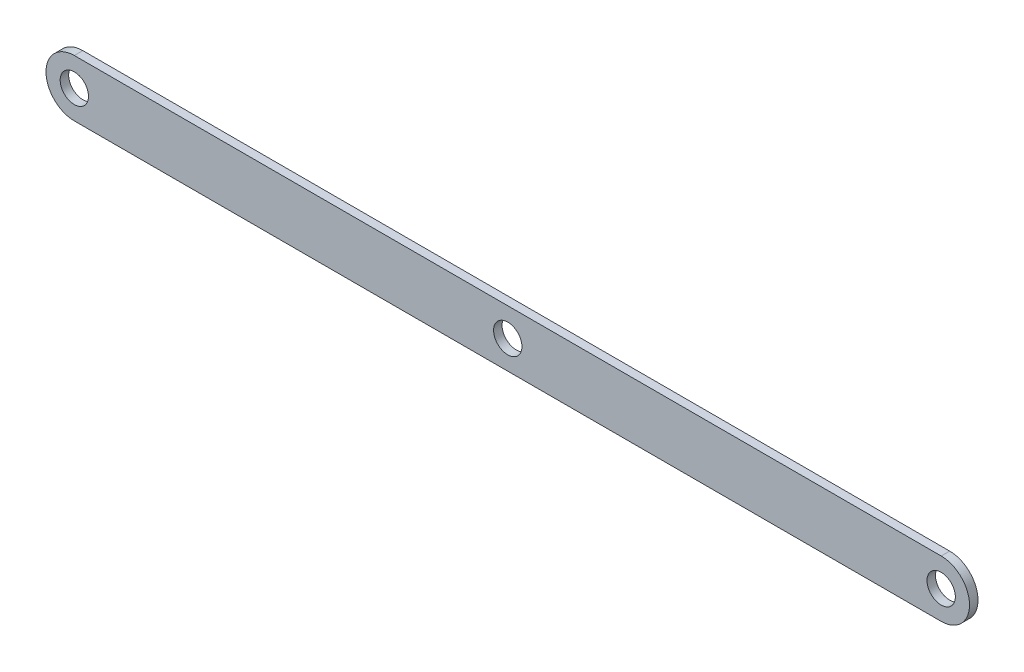
from build123d import *

# Parameters (mm, degrees)
SKETCH1_R           = 2.5
BOSS_EXTRUDE1_DEPTH = 1.5


with BuildPart() as part:
    # Sketch1 → Boss-Extrude1 (new body)
    with BuildSketch(Plane.XY):
        with BuildLine():
            Line((0, 5), (153, 5))
            ThreePointArc((153, 5), (158, 0), (153, -5))
            Line((153, -5), (0, -5))
            ThreePointArc((0, -5), (-5, 0), (0, 5))
        make_face()
        Circle(SKETCH1_R, mode=Mode.SUBTRACT)
        with Locations((153, 0)):
            Circle(SKETCH1_R, mode=Mode.SUBTRACT)
        with Locations((76.5, 0)):
            Circle(SKETCH1_R, mode=Mode.SUBTRACT)
    extrude(amount=BOSS_EXTRUDE1_DEPTH)


solid = part.part
